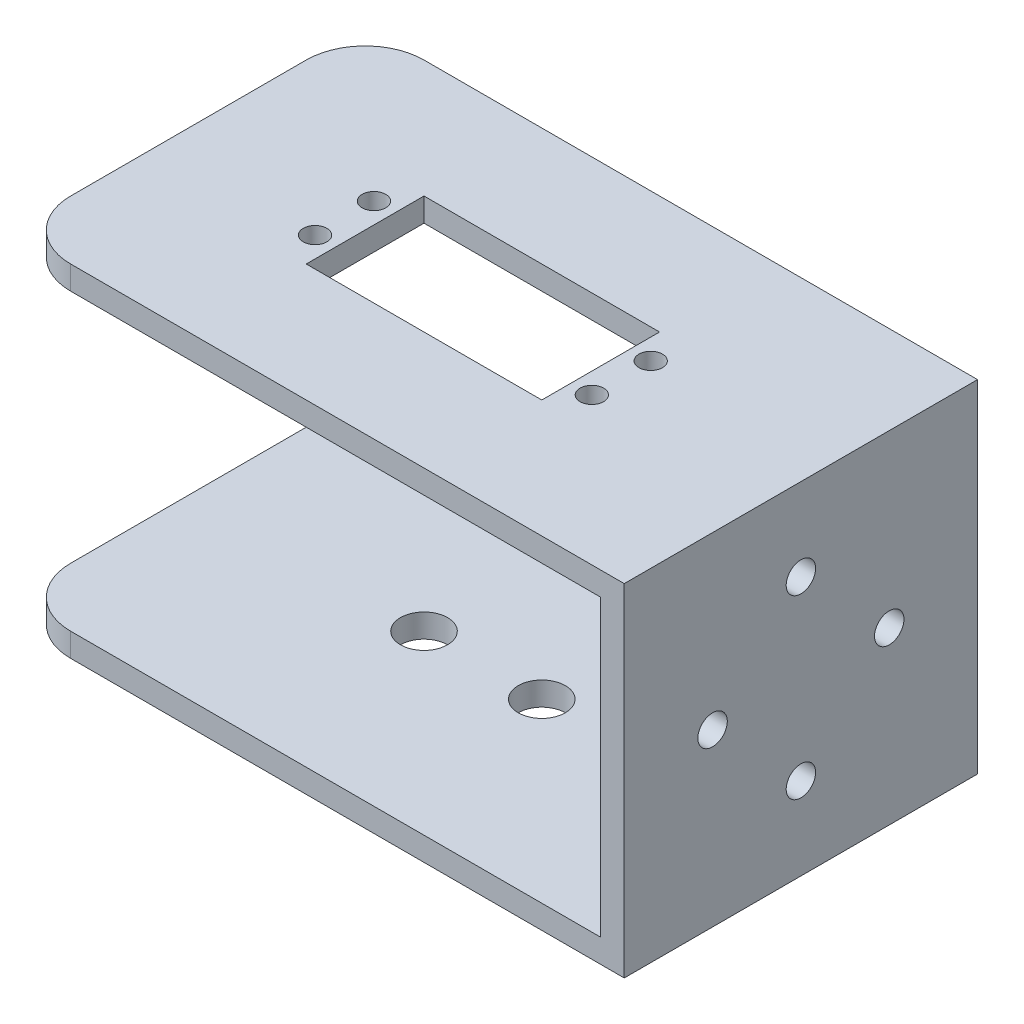
from build123d import *

# Parameters (mm, degrees)
EKSTR_ZYON_NCE1_DEPTH = 60
RADYUS1_R             = 10
KES_EKSTR_ZYON3_REACH = 133.651
IZIM3_R               = 2.5
KES_EKSTR_ZYON4_REACH = 135.342
IZIM4_R               = 2
IZIM4_W               = 40
IZIM4_H               = 20
KES_EKSTR_ZYON5_REACH = 135.342
IZIM5_R               = 4


with BuildPart() as part:
    # Çizim1 → Ekstrüzyon-İnce1 (new body)
    with BuildSketch(Plane.XY):
        Polygon((0, 0), (100, 0), (100, 50), (0, 50), (0, 54), (104, 54), (104, -4), (0, -4), align=None)
    extrude(amount=EKSTR_ZYON_NCE1_DEPTH)

    # Radyus1
    radyus1_edges = [part.edges().sort_by_distance(p)[0] for p in [
        (0, -2, 60),
        (0, 52, 60),
        (0, -2, 0),
        (0, 52, 0),
    ]]
    fillet(radyus1_edges, radius=RADYUS1_R)

    # Çizim3 → Kes-Ekstrüzyon3 (cut, up to next)
    with BuildSketch(Plane(origin=(104, 0, 0), x_dir=(0, 0, -1), z_dir=(1, 0, 0)), mode=Mode.PRIVATE) as kes_ekstr_zyon3_sk1:
        with Locations((-30, 40)):
            Circle(IZIM3_R)
    kes_ekstr_zyon3_tool1 = extrude(kes_ekstr_zyon3_sk1.sketch, amount=-KES_EKSTR_ZYON3_REACH, mode=Mode.PRIVATE) & part.part
    # Çizim3 → Kes-Ekstrüzyon3 (cut, up to next)
    with BuildSketch(Plane(origin=(104, 0, 0), x_dir=(0, 0, -1), z_dir=(1, 0, 0)), mode=Mode.PRIVATE) as kes_ekstr_zyon3_sk2:
        with Locations(Location((-30, 10, 0), (0, 0, 180))):
            Circle(IZIM3_R)
    kes_ekstr_zyon3_tool2 = extrude(kes_ekstr_zyon3_sk2.sketch, amount=-KES_EKSTR_ZYON3_REACH, mode=Mode.PRIVATE) & part.part
    # Çizim3 → Kes-Ekstrüzyon3 (cut, up to next)
    with BuildSketch(Plane(origin=(104, 0, 0), x_dir=(0, 0, -1), z_dir=(1, 0, 0)), mode=Mode.PRIVATE) as kes_ekstr_zyon3_sk3:
        with Locations((-15, 25)):
            Circle(IZIM3_R)
    kes_ekstr_zyon3_tool3 = extrude(kes_ekstr_zyon3_sk3.sketch, amount=-KES_EKSTR_ZYON3_REACH, mode=Mode.PRIVATE) & part.part
    # Çizim3 → Kes-Ekstrüzyon3 (cut, up to next)
    with BuildSketch(Plane(origin=(104, 0, 0), x_dir=(0, 0, -1), z_dir=(1, 0, 0)), mode=Mode.PRIVATE) as kes_ekstr_zyon3_sk4:
        with Locations(Location((-45, 25, 0), (0, 0, 180))):
            Circle(IZIM3_R)
    kes_ekstr_zyon3_tool4 = extrude(kes_ekstr_zyon3_sk4.sketch, amount=-KES_EKSTR_ZYON3_REACH, mode=Mode.PRIVATE) & part.part
    add(kes_ekstr_zyon3_tool1.solids().sort_by_distance((104, 40, 30))[0], mode=Mode.SUBTRACT)
    add(kes_ekstr_zyon3_tool2.solids().sort_by_distance((104, 10, 30))[0], mode=Mode.SUBTRACT)
    add(kes_ekstr_zyon3_tool3.solids().sort_by_distance((104, 25, 15))[0], mode=Mode.SUBTRACT)
    add(kes_ekstr_zyon3_tool4.solids().sort_by_distance((104, 25, 45))[0], mode=Mode.SUBTRACT)

    # Çizim4 → Kes-Ekstrüzyon4 (cut, up to next)
    with BuildSketch(Plane(origin=(0, 54, 0), x_dir=(1, 0, 0), z_dir=(0, 1, 0)), mode=Mode.PRIVATE) as kes_ekstr_zyon4_sk1:
        with Locations(Location((26.5, -25, 0), (0, 0, 180))):
            Circle(IZIM4_R)
    kes_ekstr_zyon4_tool1 = extrude(kes_ekstr_zyon4_sk1.sketch, amount=-KES_EKSTR_ZYON4_REACH, mode=Mode.PRIVATE) & part.part
    # Çizim4 → Kes-Ekstrüzyon4 (cut, up to next)
    with BuildSketch(Plane(origin=(0, 54, 0), x_dir=(1, 0, 0), z_dir=(0, 1, 0)), mode=Mode.PRIVATE) as kes_ekstr_zyon4_sk2:
        with Locations((26.5, -35)):
            Circle(IZIM4_R)
    kes_ekstr_zyon4_tool2 = extrude(kes_ekstr_zyon4_sk2.sketch, amount=-KES_EKSTR_ZYON4_REACH, mode=Mode.PRIVATE) & part.part
    # Çizim4 → Kes-Ekstrüzyon4 (cut, up to next)
    with BuildSketch(Plane(origin=(0, 54, 0), x_dir=(1, 0, 0), z_dir=(0, 1, 0)), mode=Mode.PRIVATE) as kes_ekstr_zyon4_sk3:
        with Locations(Location((73.5, -35, 0), (0, 0, 180))):
            Circle(IZIM4_R)
    kes_ekstr_zyon4_tool3 = extrude(kes_ekstr_zyon4_sk3.sketch, amount=-KES_EKSTR_ZYON4_REACH, mode=Mode.PRIVATE) & part.part
    # Çizim4 → Kes-Ekstrüzyon4 (cut, up to next)
    with BuildSketch(Plane(origin=(0, 54, 0), x_dir=(1, 0, 0), z_dir=(0, 1, 0)), mode=Mode.PRIVATE) as kes_ekstr_zyon4_sk4:
        with Locations((73.5, -25)):
            Circle(IZIM4_R)
    kes_ekstr_zyon4_tool4 = extrude(kes_ekstr_zyon4_sk4.sketch, amount=-KES_EKSTR_ZYON4_REACH, mode=Mode.PRIVATE) & part.part
    # Çizim4 → Kes-Ekstrüzyon4 (cut, up to next)
    with BuildSketch(Plane(origin=(0, 54, 0), x_dir=(1, 0, 0), z_dir=(0, 1, 0)), mode=Mode.PRIVATE) as kes_ekstr_zyon4_sk5:
        with Locations((50, -30)):
            Rectangle(IZIM4_W, IZIM4_H)
    kes_ekstr_zyon4_tool5 = extrude(kes_ekstr_zyon4_sk5.sketch, amount=-KES_EKSTR_ZYON4_REACH, mode=Mode.PRIVATE) & part.part
    add(kes_ekstr_zyon4_tool1.solids().sort_by_distance((26.5, 54, 25))[0], mode=Mode.SUBTRACT)
    add(kes_ekstr_zyon4_tool2.solids().sort_by_distance((26.5, 54, 35))[0], mode=Mode.SUBTRACT)
    add(kes_ekstr_zyon4_tool3.solids().sort_by_distance((73.5, 54, 35))[0], mode=Mode.SUBTRACT)
    add(kes_ekstr_zyon4_tool4.solids().sort_by_distance((73.5, 54, 25))[0], mode=Mode.SUBTRACT)
    add(kes_ekstr_zyon4_tool5.solids().sort_by_distance((50, 54, 30))[0], mode=Mode.SUBTRACT)

    # Çizim5 → Kes-Ekstrüzyon5 (cut, up to next)
    with BuildSketch(Plane.XZ.offset(4), mode=Mode.PRIVATE) as kes_ekstr_zyon5_sk1:
        with Locations(Location((40, 30, 0), (0, 0, 270))):
            Circle(IZIM5_R)
    kes_ekstr_zyon5_tool1 = extrude(kes_ekstr_zyon5_sk1.sketch, amount=-KES_EKSTR_ZYON5_REACH, mode=Mode.PRIVATE) & part.part
    # Çizim5 → Kes-Ekstrüzyon5 (cut, up to next)
    with BuildSketch(Plane.XZ.offset(4), mode=Mode.PRIVATE) as kes_ekstr_zyon5_sk2:
        with Locations(Location((60, 30, 0), (0, 0, 270))):
            Circle(IZIM5_R)
    kes_ekstr_zyon5_tool2 = extrude(kes_ekstr_zyon5_sk2.sketch, amount=-KES_EKSTR_ZYON5_REACH, mode=Mode.PRIVATE) & part.part
    add(kes_ekstr_zyon5_tool1.solids().sort_by_distance((40, -4, 30))[0], mode=Mode.SUBTRACT)
    add(kes_ekstr_zyon5_tool2.solids().sort_by_distance((60, -4, 30))[0], mode=Mode.SUBTRACT)


solid = part.part
